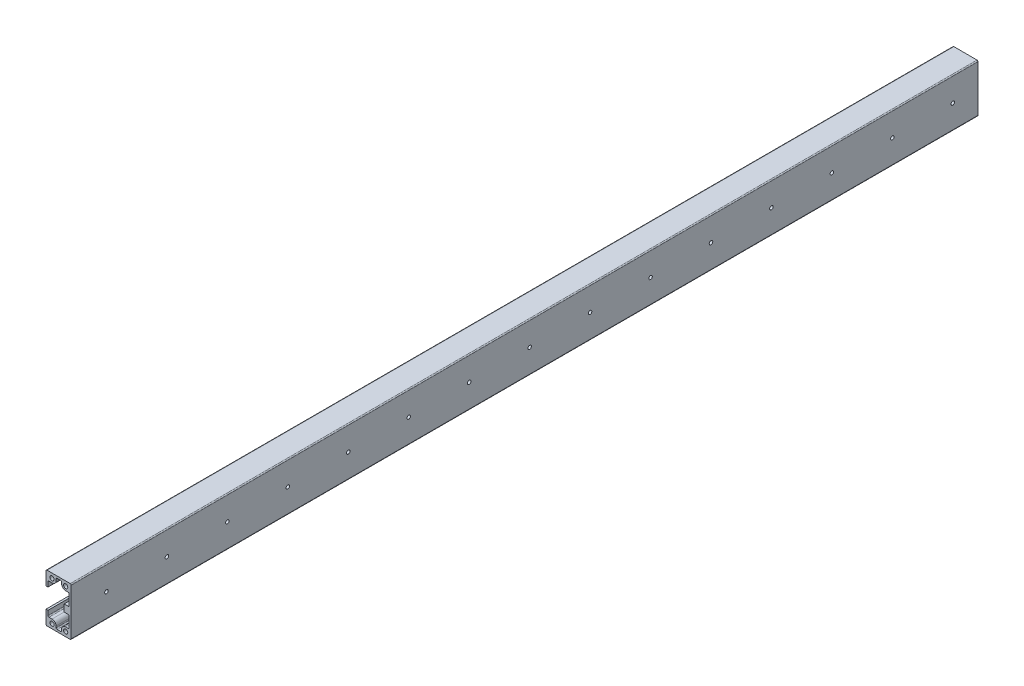
from build123d import *

# Parameters (mm, degrees)
SKETCH_1_R             = 2.1
EXTRUDE_1_DEPTH        = 900
CUT_EXTRUDE_2_REACH    = 1486.031
CUT_EXTRUDE_3_REACH    = 1486.031
SKETCH_3_R             = 1.75
HOLE_WIZARD_M5_1_D     = 4.2
HOLE_WIZARD_M5_1_DEPTH = 12.4
HOLE_WIZARD_M5_1_TIP   = 1.2618073
CUT_EXTRUDE_1_DEPTH    = 10


with BuildPart() as part:
    # 草图1 → 拉伸1 (new body)
    with BuildSketch(Plane.XY):
        with BuildLine():
            Line((1744.938567194, 1131.712493788), (1767.938567194, 1131.712493788))
            ThreePointArc((1767.938567194, 1131.712493788), (1768.645673975, 1132.005387007), (1768.938567194, 1132.712493788))
            Line((1768.938567194, 1132.712493788), (1768.938567194, 1178.712493788))
            ThreePointArc((1768.938567194, 1178.712493788), (1768.645673975, 1179.41960057), (1767.938567194, 1179.712493788))
            Line((1767.938567194, 1179.712493788), (1744.938567194, 1179.712493788))
            ThreePointArc((1744.938567194, 1179.712493788), (1744.231460413, 1179.41960057), (1743.938567194, 1178.712493788))
            Line((1743.938567194, 1178.712493788), (1743.938567194, 1132.712493788))
            ThreePointArc((1743.938567194, 1132.712493788), (1744.231460413, 1132.005387007), (1744.938567194, 1131.712493788))
        make_face()
        with Locations((1749.938567194, 1175.212493788)):
            Circle(SKETCH_1_R, mode=Mode.SUBTRACT)
        with Locations((1763.438567194, 1175.212493788)):
            Circle(SKETCH_1_R, mode=Mode.SUBTRACT)
        with Locations((1749.938567194, 1136.212493788)):
            Circle(SKETCH_1_R, mode=Mode.SUBTRACT)
        with Locations((1763.438567194, 1136.212493788)):
            Circle(SKETCH_1_R, mode=Mode.SUBTRACT)
        with BuildLine():
            Line((1754.938567194, 1133.712493788), (1758.438567194, 1133.712493788))
            ThreePointArc((1758.438567194, 1133.712493788), (1759.145673975, 1134.005387007), (1759.438567194, 1134.712493788))
            Line((1759.438567194, 1134.712493788), (1759.438567194, 1136.212493788))
            ThreePointArc((1759.438567194, 1136.212493788), (1760.61014007, 1139.040920913), (1763.438567194, 1140.212493788))
            Line((1763.438567194, 1140.212493788), (1766.938567194, 1140.212493788))
            Line((1766.938567194, 1140.212493788), (1766.938567194, 1151.212493788))
            ThreePointArc((1766.938567194, 1151.212493788), (1766.645673975, 1151.91960057), (1765.938567194, 1152.212493788))
            Line((1765.938567194, 1152.212493788), (1761.938567194, 1152.212493788))
            Line((1761.938567194, 1152.212493788), (1761.938567194, 1159.212493788))
            Line((1761.938567194, 1159.212493788), (1765.938567194, 1159.212493788))
            ThreePointArc((1765.938567194, 1159.212493788), (1766.645673975, 1159.505387007), (1766.938567194, 1160.212493788))
            Line((1766.938567194, 1160.212493788), (1766.938567194, 1171.212493788))
            Line((1766.938567194, 1171.212493788), (1763.438567194, 1171.212493788))
            ThreePointArc((1763.438567194, 1171.212493788), (1760.61014007, 1172.384066664), (1759.438567194, 1175.212493788))
            Line((1759.438567194, 1175.212493788), (1759.438567194, 1176.712493788))
            ThreePointArc((1759.438567194, 1176.712493788), (1759.145673975, 1177.41960057), (1758.438567194, 1177.712493788))
            Line((1758.438567194, 1177.712493788), (1754.938567194, 1177.712493788))
            ThreePointArc((1754.938567194, 1177.712493788), (1754.231460413, 1177.41960057), (1753.938567194, 1176.712493788))
            Line((1753.938567194, 1176.712493788), (1753.938567194, 1175.212493788))
            ThreePointArc((1753.938567194, 1175.212493788), (1752.766994319, 1172.384066664), (1749.938567194, 1171.212493788))
            Line((1749.938567194, 1171.212493788), (1746.938567194, 1171.212493789))
            ThreePointArc((1746.938567194, 1171.212493789), (1746.231460413, 1170.91960057), (1745.938567194, 1170.212493789))
            Line((1745.938567194, 1170.212493789), (1745.938567194, 1141.212493788))
            ThreePointArc((1745.938567194, 1141.212493788), (1746.231460413, 1140.505387007), (1746.938567194, 1140.212493788))
            Line((1746.938567194, 1140.212493788), (1749.938567194, 1140.212493788))
            ThreePointArc((1749.938567194, 1140.212493788), (1752.766994319, 1139.040920913), (1753.938567194, 1136.212493788))
            Line((1753.938567194, 1136.212493788), (1753.938567194, 1134.712493788))
            ThreePointArc((1753.938567194, 1134.712493788), (1754.231460413, 1134.005387007), (1754.938567194, 1133.712493788))
        make_face(mode=Mode.SUBTRACT)
    extrude(amount=EXTRUDE_1_DEPTH)

    # 草图2 → 拉伸2 (cut, up to next)
    with BuildSketch(Plane.ZY.offset(-1743.938567194), mode=Mode.PRIVATE) as cut_extrude_2_sk1:
        with BuildLine():
            Line((900, 1165.712493789), (850, 1165.712493789))
            ThreePointArc((850, 1165.712493789), (840, 1155.712493789), (850, 1145.712493789))
            Line((850, 1145.712493789), (900, 1145.712493789))
            Line((900, 1145.712493789), (900, 1165.712493789))
        make_face()
    cut_extrude_2_tool1 = extrude(cut_extrude_2_sk1.sketch, amount=-CUT_EXTRUDE_2_REACH, mode=Mode.PRIVATE) & part.part
    add(cut_extrude_2_tool1.solids().sort_by_distance((1743.938567, 1155.712494, 871.029956))[0], mode=Mode.SUBTRACT)

    # 草图3 → 拉伸3 (cut, up to next)
    with BuildSketch(Plane(origin=(1768.938567194, 0, 0), x_dir=(0, 0, -1), z_dir=(1, 0, 0)), mode=Mode.PRIVATE) as cut_extrude_3_sk1:
        with Locations((-865, 1155.712493788)):
            Circle(SKETCH_3_R)
    cut_extrude_3_tool1 = extrude(cut_extrude_3_sk1.sketch, amount=-CUT_EXTRUDE_3_REACH, mode=Mode.PRIVATE) & part.part
    # 草图3 → 拉伸3 (cut, up to next)
    with BuildSketch(Plane(origin=(1768.938567194, 0, 0), x_dir=(0, 0, -1), z_dir=(1, 0, 0)), mode=Mode.PRIVATE) as cut_extrude_3_sk2:
        with Locations((-805, 1155.712493788)):
            Circle(SKETCH_3_R)
    cut_extrude_3_tool2 = extrude(cut_extrude_3_sk2.sketch, amount=-CUT_EXTRUDE_3_REACH, mode=Mode.PRIVATE) & part.part
    # 草图3 → 拉伸3 (cut, up to next)
    with BuildSketch(Plane(origin=(1768.938567194, 0, 0), x_dir=(0, 0, -1), z_dir=(1, 0, 0)), mode=Mode.PRIVATE) as cut_extrude_3_sk3:
        with Locations((-745, 1155.712493788)):
            Circle(SKETCH_3_R)
    cut_extrude_3_tool3 = extrude(cut_extrude_3_sk3.sketch, amount=-CUT_EXTRUDE_3_REACH, mode=Mode.PRIVATE) & part.part
    # 草图3 → 拉伸3 (cut, up to next)
    with BuildSketch(Plane(origin=(1768.938567194, 0, 0), x_dir=(0, 0, -1), z_dir=(1, 0, 0)), mode=Mode.PRIVATE) as cut_extrude_3_sk4:
        with Locations((-685, 1155.712493788)):
            Circle(SKETCH_3_R)
    cut_extrude_3_tool4 = extrude(cut_extrude_3_sk4.sketch, amount=-CUT_EXTRUDE_3_REACH, mode=Mode.PRIVATE) & part.part
    # 草图3 → 拉伸3 (cut, up to next)
    with BuildSketch(Plane(origin=(1768.938567194, 0, 0), x_dir=(0, 0, -1), z_dir=(1, 0, 0)), mode=Mode.PRIVATE) as cut_extrude_3_sk5:
        with Locations((-625, 1155.712493788)):
            Circle(SKETCH_3_R)
    cut_extrude_3_tool5 = extrude(cut_extrude_3_sk5.sketch, amount=-CUT_EXTRUDE_3_REACH, mode=Mode.PRIVATE) & part.part
    # 草图3 → 拉伸3 (cut, up to next)
    with BuildSketch(Plane(origin=(1768.938567194, 0, 0), x_dir=(0, 0, -1), z_dir=(1, 0, 0)), mode=Mode.PRIVATE) as cut_extrude_3_sk6:
        with Locations((-565, 1155.712493788)):
            Circle(SKETCH_3_R)
    cut_extrude_3_tool6 = extrude(cut_extrude_3_sk6.sketch, amount=-CUT_EXTRUDE_3_REACH, mode=Mode.PRIVATE) & part.part
    # 草图3 → 拉伸3 (cut, up to next)
    with BuildSketch(Plane(origin=(1768.938567194, 0, 0), x_dir=(0, 0, -1), z_dir=(1, 0, 0)), mode=Mode.PRIVATE) as cut_extrude_3_sk7:
        with Locations((-505, 1155.712493788)):
            Circle(SKETCH_3_R)
    cut_extrude_3_tool7 = extrude(cut_extrude_3_sk7.sketch, amount=-CUT_EXTRUDE_3_REACH, mode=Mode.PRIVATE) & part.part
    # 草图3 → 拉伸3 (cut, up to next)
    with BuildSketch(Plane(origin=(1768.938567194, 0, 0), x_dir=(0, 0, -1), z_dir=(1, 0, 0)), mode=Mode.PRIVATE) as cut_extrude_3_sk8:
        with Locations((-445, 1155.712493788)):
            Circle(SKETCH_3_R)
    cut_extrude_3_tool8 = extrude(cut_extrude_3_sk8.sketch, amount=-CUT_EXTRUDE_3_REACH, mode=Mode.PRIVATE) & part.part
    # 草图3 → 拉伸3 (cut, up to next)
    with BuildSketch(Plane(origin=(1768.938567194, 0, 0), x_dir=(0, 0, -1), z_dir=(1, 0, 0)), mode=Mode.PRIVATE) as cut_extrude_3_sk9:
        with Locations((-385, 1155.712493788)):
            Circle(SKETCH_3_R)
    cut_extrude_3_tool9 = extrude(cut_extrude_3_sk9.sketch, amount=-CUT_EXTRUDE_3_REACH, mode=Mode.PRIVATE) & part.part
    # 草图3 → 拉伸3 (cut, up to next)
    with BuildSketch(Plane(origin=(1768.938567194, 0, 0), x_dir=(0, 0, -1), z_dir=(1, 0, 0)), mode=Mode.PRIVATE) as cut_extrude_3_sk10:
        with Locations((-325, 1155.712493788)):
            Circle(SKETCH_3_R)
    cut_extrude_3_tool10 = extrude(cut_extrude_3_sk10.sketch, amount=-CUT_EXTRUDE_3_REACH, mode=Mode.PRIVATE) & part.part
    # 草图3 → 拉伸3 (cut, up to next)
    with BuildSketch(Plane(origin=(1768.938567194, 0, 0), x_dir=(0, 0, -1), z_dir=(1, 0, 0)), mode=Mode.PRIVATE) as cut_extrude_3_sk11:
        with Locations((-265, 1155.712493788)):
            Circle(SKETCH_3_R)
    cut_extrude_3_tool11 = extrude(cut_extrude_3_sk11.sketch, amount=-CUT_EXTRUDE_3_REACH, mode=Mode.PRIVATE) & part.part
    # 草图3 → 拉伸3 (cut, up to next)
    with BuildSketch(Plane(origin=(1768.938567194, 0, 0), x_dir=(0, 0, -1), z_dir=(1, 0, 0)), mode=Mode.PRIVATE) as cut_extrude_3_sk12:
        with Locations((-205, 1155.712493788)):
            Circle(SKETCH_3_R)
    cut_extrude_3_tool12 = extrude(cut_extrude_3_sk12.sketch, amount=-CUT_EXTRUDE_3_REACH, mode=Mode.PRIVATE) & part.part
    # 草图3 → 拉伸3 (cut, up to next)
    with BuildSketch(Plane(origin=(1768.938567194, 0, 0), x_dir=(0, 0, -1), z_dir=(1, 0, 0)), mode=Mode.PRIVATE) as cut_extrude_3_sk13:
        with Locations((-145, 1155.712493788)):
            Circle(SKETCH_3_R)
    cut_extrude_3_tool13 = extrude(cut_extrude_3_sk13.sketch, amount=-CUT_EXTRUDE_3_REACH, mode=Mode.PRIVATE) & part.part
    # 草图3 → 拉伸3 (cut, up to next)
    with BuildSketch(Plane(origin=(1768.938567194, 0, 0), x_dir=(0, 0, -1), z_dir=(1, 0, 0)), mode=Mode.PRIVATE) as cut_extrude_3_sk14:
        with Locations((-85, 1155.712493788)):
            Circle(SKETCH_3_R)
    cut_extrude_3_tool14 = extrude(cut_extrude_3_sk14.sketch, amount=-CUT_EXTRUDE_3_REACH, mode=Mode.PRIVATE) & part.part
    # 草图3 → 拉伸3 (cut, up to next)
    with BuildSketch(Plane(origin=(1768.938567194, 0, 0), x_dir=(0, 0, -1), z_dir=(1, 0, 0)), mode=Mode.PRIVATE) as cut_extrude_3_sk15:
        with Locations((-25, 1155.712493788)):
            Circle(SKETCH_3_R)
    cut_extrude_3_tool15 = extrude(cut_extrude_3_sk15.sketch, amount=-CUT_EXTRUDE_3_REACH, mode=Mode.PRIVATE) & part.part
    add(cut_extrude_3_tool1.solids().sort_by_distance((1768.938567, 1155.712494, 865))[0], mode=Mode.SUBTRACT)
    add(cut_extrude_3_tool2.solids().sort_by_distance((1768.938567, 1155.712494, 805))[0], mode=Mode.SUBTRACT)
    add(cut_extrude_3_tool3.solids().sort_by_distance((1768.938567, 1155.712494, 745))[0], mode=Mode.SUBTRACT)
    add(cut_extrude_3_tool4.solids().sort_by_distance((1768.938567, 1155.712494, 685))[0], mode=Mode.SUBTRACT)
    add(cut_extrude_3_tool5.solids().sort_by_distance((1768.938567, 1155.712494, 625))[0], mode=Mode.SUBTRACT)
    add(cut_extrude_3_tool6.solids().sort_by_distance((1768.938567, 1155.712494, 565))[0], mode=Mode.SUBTRACT)
    add(cut_extrude_3_tool7.solids().sort_by_distance((1768.938567, 1155.712494, 505))[0], mode=Mode.SUBTRACT)
    add(cut_extrude_3_tool8.solids().sort_by_distance((1768.938567, 1155.712494, 445))[0], mode=Mode.SUBTRACT)
    add(cut_extrude_3_tool9.solids().sort_by_distance((1768.938567, 1155.712494, 385))[0], mode=Mode.SUBTRACT)
    add(cut_extrude_3_tool10.solids().sort_by_distance((1768.938567, 1155.712494, 325))[0], mode=Mode.SUBTRACT)
    add(cut_extrude_3_tool11.solids().sort_by_distance((1768.938567, 1155.712494, 265))[0], mode=Mode.SUBTRACT)
    add(cut_extrude_3_tool12.solids().sort_by_distance((1768.938567, 1155.712494, 205))[0], mode=Mode.SUBTRACT)
    add(cut_extrude_3_tool13.solids().sort_by_distance((1768.938567, 1155.712494, 145))[0], mode=Mode.SUBTRACT)
    add(cut_extrude_3_tool14.solids().sort_by_distance((1768.938567, 1155.712494, 85))[0], mode=Mode.SUBTRACT)
    add(cut_extrude_3_tool15.solids().sort_by_distance((1768.938567, 1155.712494, 25))[0], mode=Mode.SUBTRACT)

    # M5 螺纹孔1
    with Locations(Plane.ZY.offset(-1743.938567194)):
        with Locations((44.5, 1136.712493789), (70.5, 1136.712493789), (96.5, 1136.712493789), (122.5, 1136.712493789)):
            Hole(HOLE_WIZARD_M5_1_D / 2, depth=HOLE_WIZARD_M5_1_DEPTH)
            with Locations((0, 0, -(HOLE_WIZARD_M5_1_DEPTH + HOLE_WIZARD_M5_1_TIP / 2))):  # 118° drill point
                Cone(0, HOLE_WIZARD_M5_1_D / 2, HOLE_WIZARD_M5_1_TIP, mode=Mode.SUBTRACT)

    # 草图6 → 切除-拉伸1 (cut)
    with BuildSketch(Plane.ZY.offset(-1743.938567194)):
        with BuildLine():
            Line((115, 1166.353684065), (165, 1166.353684065))
            ThreePointArc((165, 1166.353684065), (176, 1155.353684065), (165, 1144.353684065))
            Line((165, 1144.353684065), (115, 1144.353684065))
            ThreePointArc((115, 1144.353684065), (104, 1155.353684065), (115, 1166.353684065))
        make_face()
    extrude(amount=-CUT_EXTRUDE_1_DEPTH, mode=Mode.SUBTRACT)


solid = part.part
